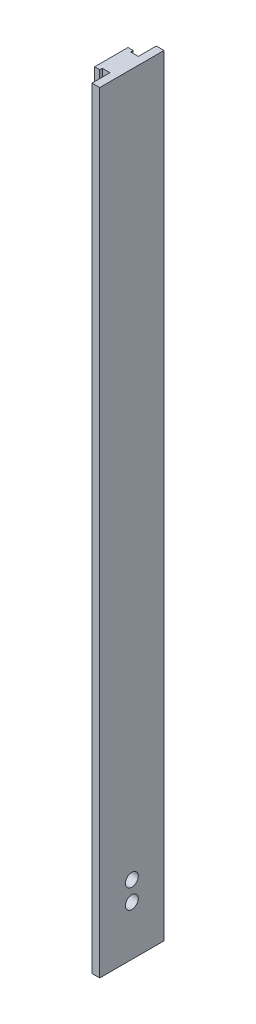
from build123d import *

# Parameters (mm, degrees)
CROQUIS1_W              = 25
CROQUIS1_H              = 300
SALIENTE_EXTRUIR1_DEPTH = 8
CORTAR_EXTRUIR1_DEPTH   = 301.454304751
CROQUIS3_R              = 2.5
CORTAR_EXTRUIR2_DEPTH   = 272.718032041


with BuildPart() as part:
    # Croquis1 → Saliente-Extruir1 (new body)
    with BuildSketch(Plane(origin=(0, 0, 0), x_dir=(0, 0, -1), z_dir=(1, 0, 0))):
        with Locations((1.949541284, -121.21559633)):
            Rectangle(CROQUIS1_W, CROQUIS1_H)
    extrude(amount=SALIENTE_EXTRUIR1_DEPTH)

    # Croquis2 → Cortar-Extruir1 (cut, through all)
    with BuildSketch(Plane(origin=(0, 28.78440367, 0), x_dir=(1, 0, 0), z_dir=(0, 1, 0))):
        Polygon((2, 8.451958984), (2, 7.451958984), (5, 7.451958984), (5, 14.449541284), (0, 14.449541284), (0, 8.451958984), align=None)
        Polygon((5, -10.550458716), (0, -10.550458716), (0, -4.552876416), (2, -4.552876416), (2, -3.552876416), (5, -3.552876416), align=None)
    extrude(amount=-CORTAR_EXTRUIR1_DEPTH, mode=Mode.SUBTRACT)

    # Croquis3 → Cortar-Extruir2 (cut, through all)
    with BuildSketch(Plane(origin=(8, 0, 0), x_dir=(0, 0, -1), z_dir=(1, 0, 0))):
        with Locations((1.949541284, -251.876037927)):
            Circle(CROQUIS3_R)
        with Locations((1.949541284, -244.376037927)):
            Circle(CROQUIS3_R)
    extrude(amount=-CORTAR_EXTRUIR2_DEPTH, mode=Mode.SUBTRACT)


solid = part.part
